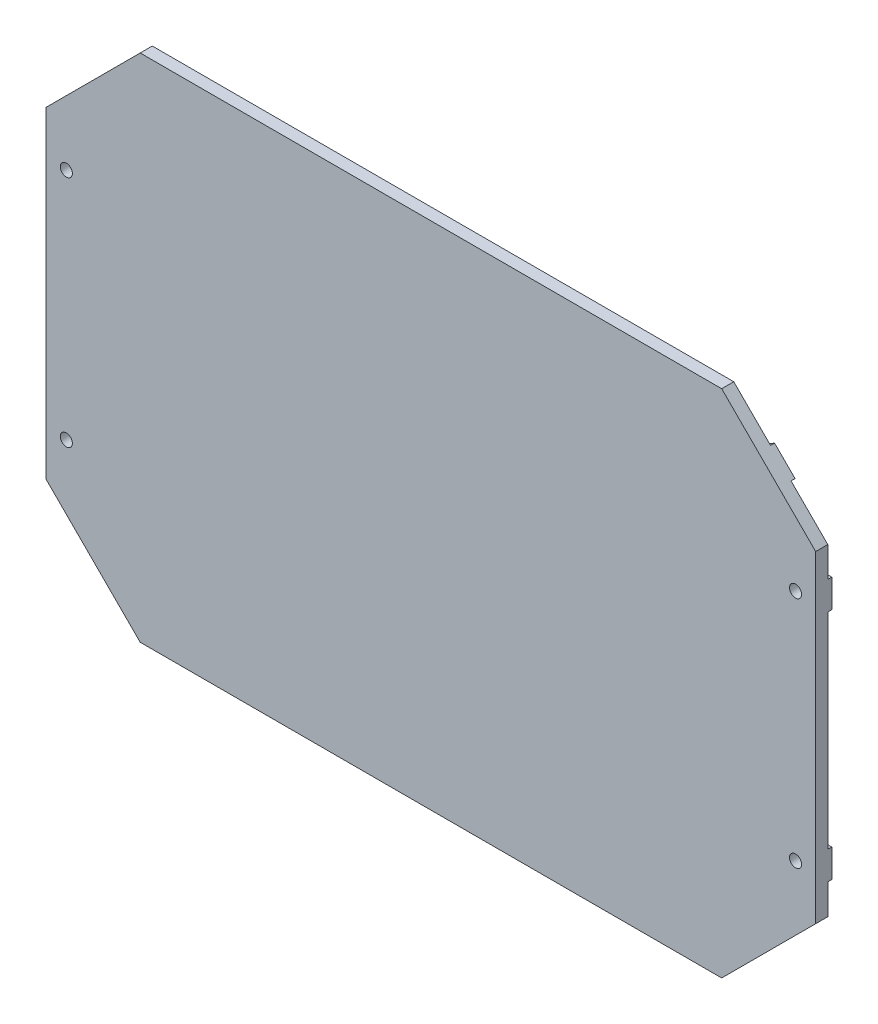
from build123d import *
from build123d.topology import SkipClean

# Parameters (mm, degrees)
SKETCH1_R           = 1.5
BOSS_EXTRUDE1_DEPTH = 3
BOSS_EXTRUDE2_START = 1
SKETCH2_R           = 1.5
BOSS_EXTRUDE2_DEPTH = 1


with BuildPart() as part:
    # Sketch1 → Boss-Extrude1 (new body)
    with BuildSketch(Plane.XY):
        Polygon((-95.5, -40), (-95.5, 40), (-72.165476221, 63.334523779), (72.165476221, 63.334523779), (95.5, 40), (95.5, -40), (72.165476221, -63.334523779), (-72.165476221, -63.334523779), align=None)
        with Locations((-90.5, 29)):
            Circle(SKETCH1_R, mode=Mode.SUBTRACT)
        with Locations((-90.5, -29)):
            Circle(SKETCH1_R, mode=Mode.SUBTRACT)
        with Locations(Location((90.5, -29, 0), (0, 0, 180))):
            Circle(SKETCH1_R, mode=Mode.SUBTRACT)
        with Locations(Location((90.5, 29, 0), (0, 0, 180))):
            Circle(SKETCH1_R, mode=Mode.SUBTRACT)
    extrude(amount=BOSS_EXTRUDE1_DEPTH)

    # Sketch2 → Boss-Extrude2 (add)
    # profile 1 of 19: a face of its own
    with SkipClean():  # the faces are left unmerged after this step: merging them gives an invalid solid
        with BuildSketch(Plane(origin=(0, 0, 0), x_dir=(-1, 0, 0), z_dir=(0, 0, -1)).offset(BOSS_EXTRUDE2_START)):
            Polygon((-59.403736545, 32.5), (-46.062041549, 32.5), (-81.28908922, 54.21091078), (-86.376387001, 49.123612999), align=None)
        # profile 2 of 19: a face of its own
        with BuildSketch(Plane(origin=(0, 0, 0), x_dir=(-1, 0, 0), z_dir=(0, 0, -1)).offset(BOSS_EXTRUDE2_START)):
            Polygon((-34.704188524, 25.5), (-46.062041549, 32.5), (-59.403736545, 32.5), (-48.045883519, 25.5), align=None)
        # profile 3 of 19: a face of its own
        with BuildSketch(Plane(origin=(0, 0, 0), x_dir=(-1, 0, 0), z_dir=(0, 0, -1)).offset(BOSS_EXTRUDE2_START)):
            Polygon((-48.045883519, 25.5), (-59.403736545, 32.5), (-95.5, 32.5), (-95.5, 25.5), align=None)
            with Locations((-90.5, 29)):
                Circle(SKETCH2_R, mode=Mode.SUBTRACT)
        # profile 4 of 19: a face of its own
        with BuildSketch(Plane(origin=(0, 0, 0), x_dir=(-1, 0, 0), z_dir=(0, 0, -1)).offset(BOSS_EXTRUDE2_START)):
            Polygon((34.704188524, 25.5), (46.062041549, 32.5), (-46.062041549, 32.5), (-34.704188524, 25.5), align=None)
        # profile 5 of 19: a face of its own
        with BuildSketch(Plane(origin=(0, 0, 0), x_dir=(-1, 0, 0), z_dir=(0, 0, -1)).offset(BOSS_EXTRUDE2_START)):
            Polygon((59.403736545, 32.5), (46.062041549, 32.5), (34.704188524, 25.5), (48.045883519, 25.5), align=None)
        # profile 6 of 19: a face of its own
        with BuildSketch(Plane(origin=(0, 0, 0), x_dir=(-1, 0, 0), z_dir=(0, 0, -1)).offset(BOSS_EXTRUDE2_START)):
            Polygon((86.376387001, 49.123612999), (81.28908922, 54.21091078), (46.062041549, 32.5), (59.403736545, 32.5), align=None)
        # profile 7 of 19: a face of its own
        with BuildSketch(Plane(origin=(0, 0, 0), x_dir=(-1, 0, 0), z_dir=(0, 0, -1)).offset(BOSS_EXTRUDE2_START)):
            Polygon((95.5, 32.5), (59.403736545, 32.5), (48.045883519, 25.5), (95.5, 25.5), align=None)
            with Locations((90.5, 29)):
                Circle(SKETCH2_R, mode=Mode.SUBTRACT)
        # profile 8 of 19: a face of its own
        with BuildSketch(Plane(origin=(0, 0, 0), x_dir=(-1, 0, 0), z_dir=(0, 0, -1)).offset(BOSS_EXTRUDE2_START)):
            Polygon((-6.670847498, 0), (0, 4.111334455), (-34.704188524, 25.5), (-48.045883519, 25.5), align=None)
        # profile 9 of 19: a face of its own
        with BuildSketch(Plane(origin=(0, 0, 0), x_dir=(-1, 0, 0), z_dir=(0, 0, -1)).offset(BOSS_EXTRUDE2_START)):
            Polygon((48.045883519, 25.5), (34.704188524, 25.5), (0, 4.111334455), (6.670847498, 0), align=None)
        # profile 10 of 19: a face of its own
        with BuildSketch(Plane(origin=(0, 0, 0), x_dir=(-1, 0, 0), z_dir=(0, 0, -1)).offset(BOSS_EXTRUDE2_START)):
            Polygon((6.670847498, 0), (0, 4.111334455), (-6.670847498, 0), (0, -4.111334455), align=None)
        # profile 11 of 19: a face of its own
        with BuildSketch(Plane(origin=(0, 0, 0), x_dir=(-1, 0, 0), z_dir=(0, 0, -1)).offset(BOSS_EXTRUDE2_START)):
            Polygon((48.045883519, -25.5), (6.670847498, 0), (0, -4.111334455), (34.704188524, -25.5), align=None)
        # profile 12 of 19: a face of its own
        with BuildSketch(Plane(origin=(0, 0, 0), x_dir=(-1, 0, 0), z_dir=(0, 0, -1)).offset(BOSS_EXTRUDE2_START)):
            Polygon((0, -4.111334455), (-6.670847498, 0), (-48.045883519, -25.5), (-34.704188524, -25.5), align=None)
        # profile 13 of 19: a face of its own
        with BuildSketch(Plane(origin=(0, 0, 0), x_dir=(-1, 0, 0), z_dir=(0, 0, -1)).offset(BOSS_EXTRUDE2_START)):
            Polygon((-34.704188524, -25.5), (-48.045883519, -25.5), (-59.403736545, -32.5), (-46.062041549, -32.5), align=None)
        # profile 14 of 19: a face of its own
        with BuildSketch(Plane(origin=(0, 0, 0), x_dir=(-1, 0, 0), z_dir=(0, 0, -1)).offset(BOSS_EXTRUDE2_START)):
            Polygon((-59.403736545, -32.5), (-48.045883519, -25.5), (-95.5, -25.5), (-95.5, -32.5), align=None)
            with Locations((-90.5, -29)):
                Circle(SKETCH2_R, mode=Mode.SUBTRACT)
        # profile 15 of 19: a face of its own
        with BuildSketch(Plane(origin=(0, 0, 0), x_dir=(-1, 0, 0), z_dir=(0, 0, -1)).offset(BOSS_EXTRUDE2_START)):
            Polygon((34.704188524, -25.5), (-34.704188524, -25.5), (-46.062041549, -32.5), (46.062041549, -32.5), align=None)
        # profile 16 of 19: a face of its own
        with BuildSketch(Plane(origin=(0, 0, 0), x_dir=(-1, 0, 0), z_dir=(0, 0, -1)).offset(BOSS_EXTRUDE2_START)):
            Polygon((59.403736545, -32.5), (48.045883519, -25.5), (34.704188524, -25.5), (46.062041549, -32.5), align=None)
        # profile 17 of 19: a face of its own
        with BuildSketch(Plane(origin=(0, 0, 0), x_dir=(-1, 0, 0), z_dir=(0, 0, -1)).offset(BOSS_EXTRUDE2_START)):
            Polygon((95.5, -25.5), (48.045883519, -25.5), (59.403736545, -32.5), (95.5, -32.5), align=None)
            with Locations((90.5, -29)):
                Circle(SKETCH2_R, mode=Mode.SUBTRACT)
        # profile 18 of 19: a face of its own
        with BuildSketch(Plane(origin=(0, 0, 0), x_dir=(-1, 0, 0), z_dir=(0, 0, -1)).offset(BOSS_EXTRUDE2_START)):
            Polygon((86.376387001, -49.123612999), (59.403736545, -32.5), (46.062041549, -32.5), (81.28908922, -54.21091078), align=None)
        # profile 19 of 19: a face of its own
        with BuildSketch(Plane(origin=(0, 0, 0), x_dir=(-1, 0, 0), z_dir=(0, 0, -1)).offset(BOSS_EXTRUDE2_START)):
            Polygon((-46.062041549, -32.5), (-59.403736545, -32.5), (-86.376387001, -49.123612999), (-81.28908922, -54.21091078), align=None)
        extrude(amount=-BOSS_EXTRUDE2_DEPTH)


solid = part.part
